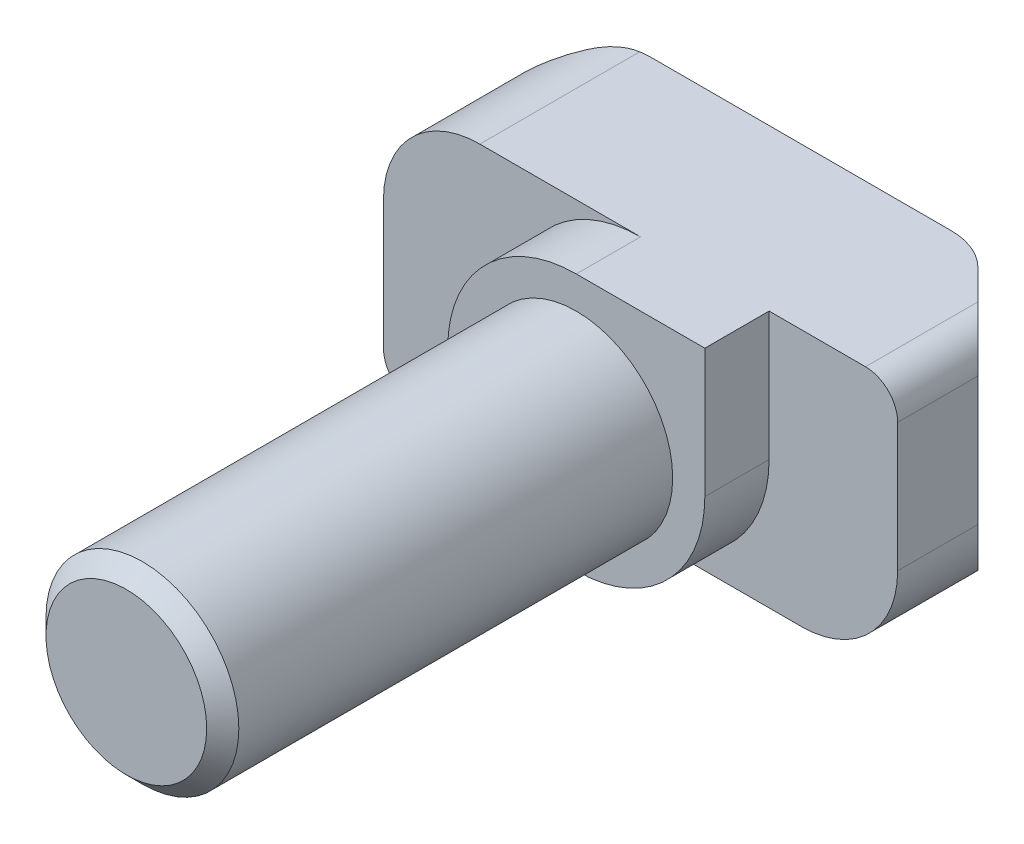
from build123d import *

# Parameters (mm, degrees)
EXTRUDE_1_DEPTH     = 8
SKETCH_2_W          = 4
SKETCH_2_H          = 2
CUT_EXTRUDE_1_DEPTH = 14.304134696
SKETCH_3_W          = 4
SKETCH_3_H          = 2
CUT_EXTRUDE_2_DEPTH = 14.304134696
SKETCH_4_W          = 3
SKETCH_4_H          = 14
CHAMFER_1_SIZE      = 0.500002905
CHAMFER_1_SIZE2     = 0.500003995
FILLET_1_R          = 1
FILLET_2_R          = 2
FILLET_3_R          = 3
FILLET_4_R          = 4


with BuildPart() as part:
    # 草图1 → 凸台-拉伸1 (new body)
    with BuildSketch(Plane(origin=(0, 4, 0), x_dir=(1, 0, 0), z_dir=(0, 1, 0))):
        Polygon((-8, -7), (8, -7), (8, -2.5), (5.5, 0), (-5.5, 0), (-8, -2.5), align=None)
    extrude(amount=-EXTRUDE_1_DEPTH)

    # 草图2 → 切除-拉伸1 (cut, through all)
    with BuildSketch(Plane.XZ.offset(4)):
        with Locations((-6, 6)):
            Rectangle(SKETCH_2_W, SKETCH_2_H)
    extrude(amount=-CUT_EXTRUDE_1_DEPTH, mode=Mode.SUBTRACT)

    # 草图3 → 切除-拉伸2 (cut, through all)
    with BuildSketch(Plane.XZ.offset(4)):
        with Locations((6, 6)):
            Rectangle(SKETCH_3_W, SKETCH_3_H)
    extrude(amount=-CUT_EXTRUDE_2_DEPTH, mode=Mode.SUBTRACT)

    # 草图4 → 旋转1 (revolve)
    with BuildSketch(Plane(origin=(0, 0, 0), x_dir=(1, 0, 0), z_dir=(0, 1, 0))):
        with Locations((1.5, -14)):
            Rectangle(SKETCH_4_W, SKETCH_4_H)
    revolve(axis=Axis((0, 0, 7), (0, 0, 1)))

    # 倒角1
    chamfer_1_edges = [part.edges().sort_by_distance(p)[0] for p in [
        (-3, 0, 21),
    ]]
    chamfer_1_side = [part.faces().sort_by_distance(p)[0] for p in [
        (-3, 0, 14),
    ]]
    chamfer(chamfer_1_edges, length=CHAMFER_1_SIZE, length2=CHAMFER_1_SIZE2, reference=chamfer_1_side[0])

    # 圆角1
    fillet_1_edges = [part.edges().sort_by_distance(p)[0] for p in [
        (8, 4, 3.75),
        (-8, -4, 3.75),
    ]]
    fillet(fillet_1_edges, radius=FILLET_1_R)

    # 圆角2
    fillet_2_edges = [part.edges().sort_by_distance(p)[0] for p in [
        (-5.5, 0, 0),
        (5.5, 0, 0),
    ]]
    fillet(fillet_2_edges, radius=FILLET_2_R)

    # 圆角3
    fillet_3_edges = [part.edges().sort_by_distance(p)[0] for p in [
        (8, -4, 3.75),
        (-8, 4, 3.75),
    ]]
    fillet(fillet_3_edges, radius=FILLET_3_R)

    # 圆角4
    fillet_4_edges = [part.edges().sort_by_distance(p)[0] for p in [
        (-4, 4, 6),
        (4, -4, 6),
    ]]
    fillet(fillet_4_edges, radius=FILLET_4_R)


solid = part.part
